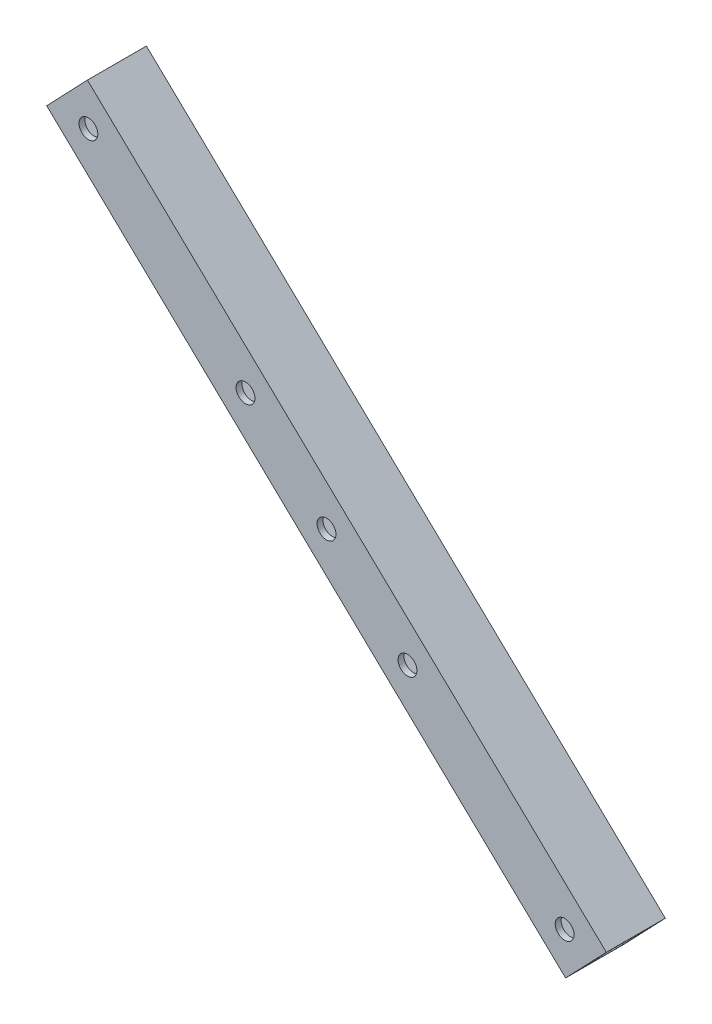
from build123d import *

# Parameters (mm, degrees)
SKETCH_2_R          = 1.6
EXTRUDE_1_DEPTH     = 10
SKETCH_3_W          = 8
SKETCH_3_H          = 8
CUT_EXTRUDE_1_DEPTH = 140.947387002
SKETCH_4_R          = 1.6
CUT_EXTRUDE_2_DEPTH = 10


with BuildPart() as part:
    # ｽｹｯﾁ2 → ﾎﾞｽ - 押し出し1 (new body)
    with BuildSketch(Plane.XY):
        Polygon((83.071643169, 8.195972832), (-3.936021884, 91.354077293), (-10.845357286, 84.124894469), (77.150331852, 0.022479987), (84.059667254, 7.25166281), align=None)
        with Locations((-3.776098173, 84.28481818)):
            Circle(SKETCH_2_R, mode=Mode.SUBTRACT)
        with Locations((76.990408141, 7.0917391)):
            Circle(SKETCH_2_R, mode=Mode.SUBTRACT)
    extrude(amount=EXTRUDE_1_DEPTH)

    # ｽｹｯﾁ3 → ｶｯﾄ - 押し出し1 (cut, through all)
    with BuildSketch(Plane(origin=(40.308371471, -38.524970914, 0), x_dir=(0, 0, -1), z_dir=(0.7229182823698357, -0.690933540230496, 0))):
        with Locations((-5, 58.32200311)):
            Rectangle(SKETCH_3_W, SKETCH_3_H)
    extrude(amount=-CUT_EXTRUDE_1_DEPTH, mode=Mode.SUBTRACT)

    # ｽｹｯﾁ4 → ｶｯﾄ - 押し出し2 (cut)
    with BuildSketch(Plane.XY.offset(10)):
        with Locations((50.342602349, 32.560541375)):
            Circle(SKETCH_4_R)
        with Locations((22.871707619, 58.816015904)):
            Circle(SKETCH_4_R)
        with Locations((36.607154984, 45.68827864)):
            Circle(SKETCH_4_R)
    extrude(amount=-CUT_EXTRUDE_2_DEPTH, mode=Mode.SUBTRACT)


solid = part.part
